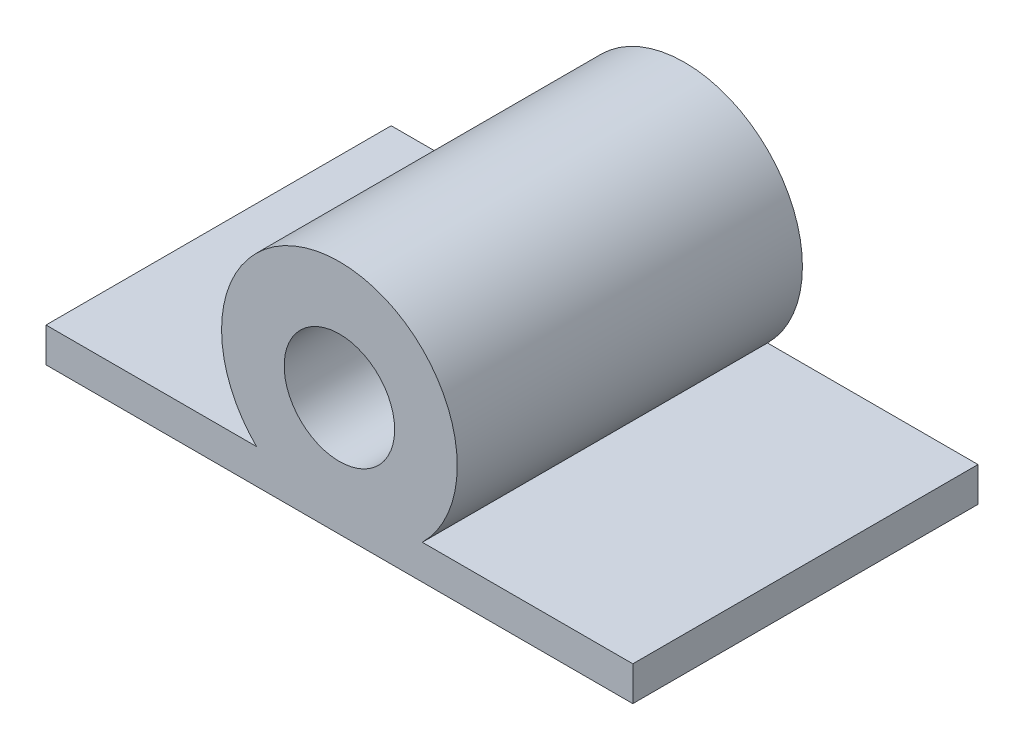
from build123d import *

# Parameters (mm, degrees)
SKETCH2_W           = 85
SKETCH2_H           = 50
BOSS_EXTRUDE2_DEPTH = 5
SKETCH3_R           = 17.0688374
SKETCH3_R_2         = 8
BOSS_EXTRUDE4_DEPTH = 50
SKETCH5_R           = 1.5
CUT_EXTRUDE1_DEPTH  = 50


with BuildPart() as part:
    # Sketch2 → Boss-Extrude2 (new body)
    with BuildSketch(Plane(origin=(0, 0, 0), x_dir=(1, 0, 0), z_dir=(0, 1, 0))):
        with Locations((42.5, 25)):
            Rectangle(SKETCH2_W, SKETCH2_H)
    extrude(amount=BOSS_EXTRUDE2_DEPTH)

    # Sketch3 → Boss-Extrude4 (add)
    with BuildSketch(Plane.XY):
        with Locations((42.5, 17.131570827)):
            Circle(SKETCH3_R)
        with Locations((42.5, 17.131570827)):
            Circle(SKETCH3_R_2, mode=Mode.SUBTRACT)
    extrude(amount=-BOSS_EXTRUDE4_DEPTH)

    # Sketch5 → Cut-Extrude1 (cut)
    with BuildSketch(Plane(origin=(0, 5, 0), x_dir=(1, 0, 0), z_dir=(0, 1, 0))):
        with Locations(Location((11.665290462, 36.170405123, 0), (0, 0, 270))):
            Circle(SKETCH5_R)
    extrude(amount=-CUT_EXTRUDE1_DEPTH, mode=Mode.SUBTRACT)


solid = part.part
